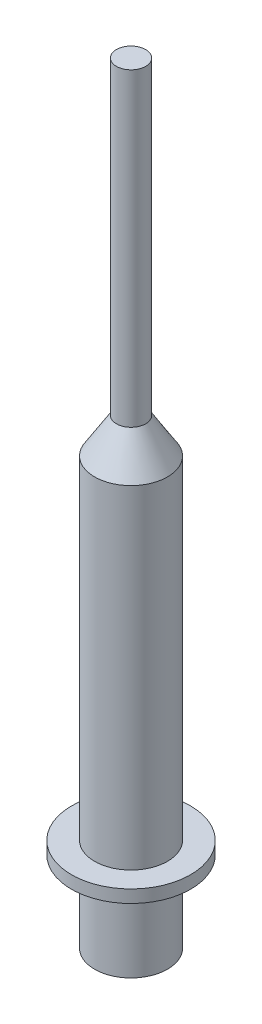
from build123d import *

# Parameters (mm, degrees)
SKETCH1_R           = 3.9624
BOSS_EXTRUDE1_DEPTH = 46.355
SKETCH3_R           = 3.9624
SKETCH2_R           = 1.5875
SKETCH4_R           = 1.5875
BOSS_EXTRUDE2_DEPTH = 33.655
SKETCH5_R           = 6.477
BOSS_EXTRUDE3_DEPTH = 1.3716


with BuildPart() as part:
    # Sketch1 → Boss-Extrude1 (new body)
    with BuildSketch(Plane(origin=(0, 0, 0), x_dir=(1, 0, 0), z_dir=(0, 1, 0))):
        with Locations(Location((0, 0, 0), (0, 0, 90))):
            Circle(SKETCH1_R)
    extrude(amount=BOSS_EXTRUDE1_DEPTH)

    # Sketch3 → Loft1 section 0
    with BuildSketch(Plane(origin=(0, 46.355, 0), x_dir=(1, 0, 0), z_dir=(0, 1, 0))):
        Circle(SKETCH3_R)
    # Sketch2 → Loft1 section 1
    with BuildSketch(Plane(origin=(0, 50.165, 0), x_dir=(1, 0, 0), z_dir=(0, 1, 0))):
        Circle(SKETCH2_R)
    loft()

    # Sketch4 → Boss-Extrude2 (add)
    with BuildSketch(Plane(origin=(0, 50.165, 0), x_dir=(1, 0, 0), z_dir=(0, 1, 0))):
        with Locations(Location((0, 0, 0), (0, 0, 270))):
            Circle(SKETCH4_R)
    extrude(amount=BOSS_EXTRUDE2_DEPTH)

    # Sketch5 → Boss-Extrude3 (add)
    with BuildSketch(Plane(origin=(0, 10.16, 0), x_dir=(-1, 0, 0), z_dir=(0, -1, 0))):
        with Locations(Location((0, 0, 0), (0, 0, 90))):
            Circle(SKETCH5_R)
    extrude(amount=BOSS_EXTRUDE3_DEPTH)


solid = part.part
